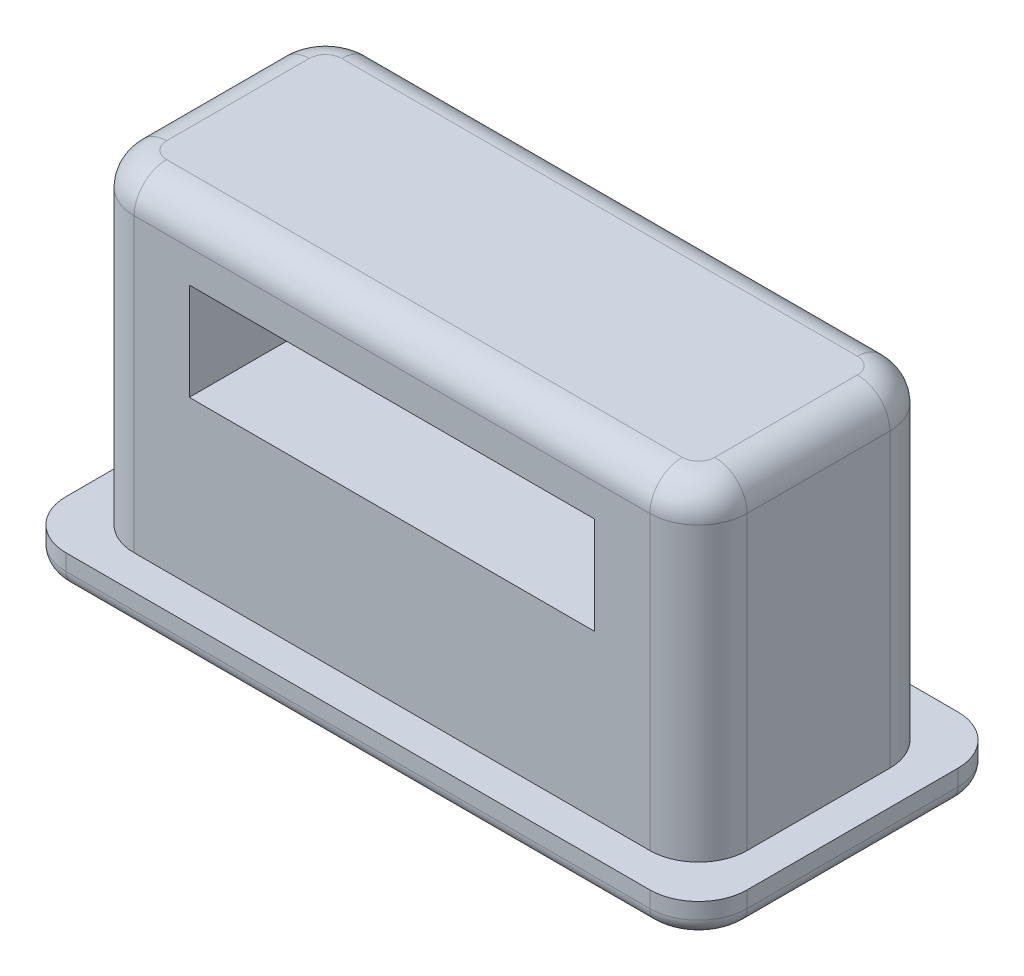
from build123d import *

# Parameters (mm, degrees)
SKETCH1_W           = 42
SKETCH1_H           = 19
BOSS_EXTRUDE1_DEPTH = 2
FILLET1_R           = 3
FILLET2_R           = 1
SKETCH2_W           = 37.8
SKETCH2_H           = 14.8
BOSS_EXTRUDE2_DEPTH = 10
SKETCH3_W           = 6.4
SKETCH3_H           = 14.8
BOSS_EXTRUDE3_DEPTH = 10
SKETCH5_W           = 14.8
SKETCH5_H           = 4
BOSS_EXTRUDE4_DEPTH = 25
FILLET4_R           = 3
FILLET5_R           = 2


with BuildPart() as part:
    # Sketch1 → Boss-Extrude1 (new body)
    with BuildSketch(Plane(origin=(0, 0, 0), x_dir=(1, 0, 0), z_dir=(0, 1, 0))):
        with Locations((-35.747676634, 5.960595817)):
            Rectangle(SKETCH1_W, SKETCH1_H)
    extrude(amount=BOSS_EXTRUDE1_DEPTH)

    # Fillet1
    fillet1_edges = [part.edges().sort_by_distance(p)[0] for p in [
        (-56.747676634, 1, -15.460595817),
        (-14.747676634, 1, -15.460595817),
        (-14.747676634, 1, 3.539404183),
        (-56.747676634, 1, 3.539404183),
    ]]
    fillet(fillet1_edges, radius=FILLET1_R)

    # Fillet2
    fillet2_edges = [part.edges().sort_by_distance(p)[0] for p in [
        (-56.747676634, 0, -5.960595817),
        (-35.747676634, 0, -15.460595817),
        (-14.747676634, 0, -5.960595817),
        (-35.747676634, 0, 3.539404183),
        (-15.62635629, 0, 2.660724527),
        (-15.62635629, 0, -14.58191616),
        (-55.868996977, 0, 2.660724527),
        (-55.868996977, 0, -14.58191616),
    ]]
    fillet(fillet2_edges, radius=FILLET2_R)

    # Sketch2 → Boss-Extrude2 (add)
    with BuildSketch(Plane(origin=(0, 2, 0), x_dir=(1, 0, 0), z_dir=(0, 1, 0))):
        with Locations((-35.747676634, 5.960595817)):
            Rectangle(SKETCH2_W, SKETCH2_H)
    extrude(amount=BOSS_EXTRUDE2_DEPTH)

    # Sketch3 → Boss-Extrude3 (add)
    with BuildSketch(Plane(origin=(0, 12, 0), x_dir=(1, 0, 0), z_dir=(0, 1, 0))):
        with Locations((-20.047676634, 5.960595817)):
            Rectangle(SKETCH3_W, SKETCH3_H)
        with Locations((-51.447676634, 5.960595817)):
            Rectangle(SKETCH3_W, SKETCH3_H)
    extrude(amount=BOSS_EXTRUDE3_DEPTH)

    # Sketch5 → Boss-Extrude4 (add)
    with BuildSketch(Plane(origin=(-48.247676634, 0, 0), x_dir=(0, 0, -1), z_dir=(1, 0, 0))):
        with Locations((5.960595817, 20)):
            Rectangle(SKETCH5_W, SKETCH5_H)
    extrude(amount=BOSS_EXTRUDE4_DEPTH)

    # Fillet4
    fillet4_edges = [part.edges().sort_by_distance(p)[0] for p in [
        (-54.647676634, 12, -13.360595817),
        (-54.647676634, 12, 1.439404183),
        (-16.847676634, 12, 1.439404183),
        (-16.847676634, 12, -13.360595817),
    ]]
    fillet(fillet4_edges, radius=FILLET4_R)

    # Fillet5
    fillet5_edges = [part.edges().sort_by_distance(p)[0] for p in [
        (-35.747676634, 22, -13.360595817),
        (-16.847676634, 22, -5.960595817),
        (-35.747676634, 22, 1.439404183),
        (-54.647676634, 22, -5.960595817),
        (-53.768996977, 22, 0.560724527),
        (-53.768996977, 22, -12.48191616),
        (-17.72635629, 22, 0.560724527),
        (-17.72635629, 22, -12.48191616),
    ]]
    fillet(fillet5_edges, radius=FILLET5_R)


solid = part.part
